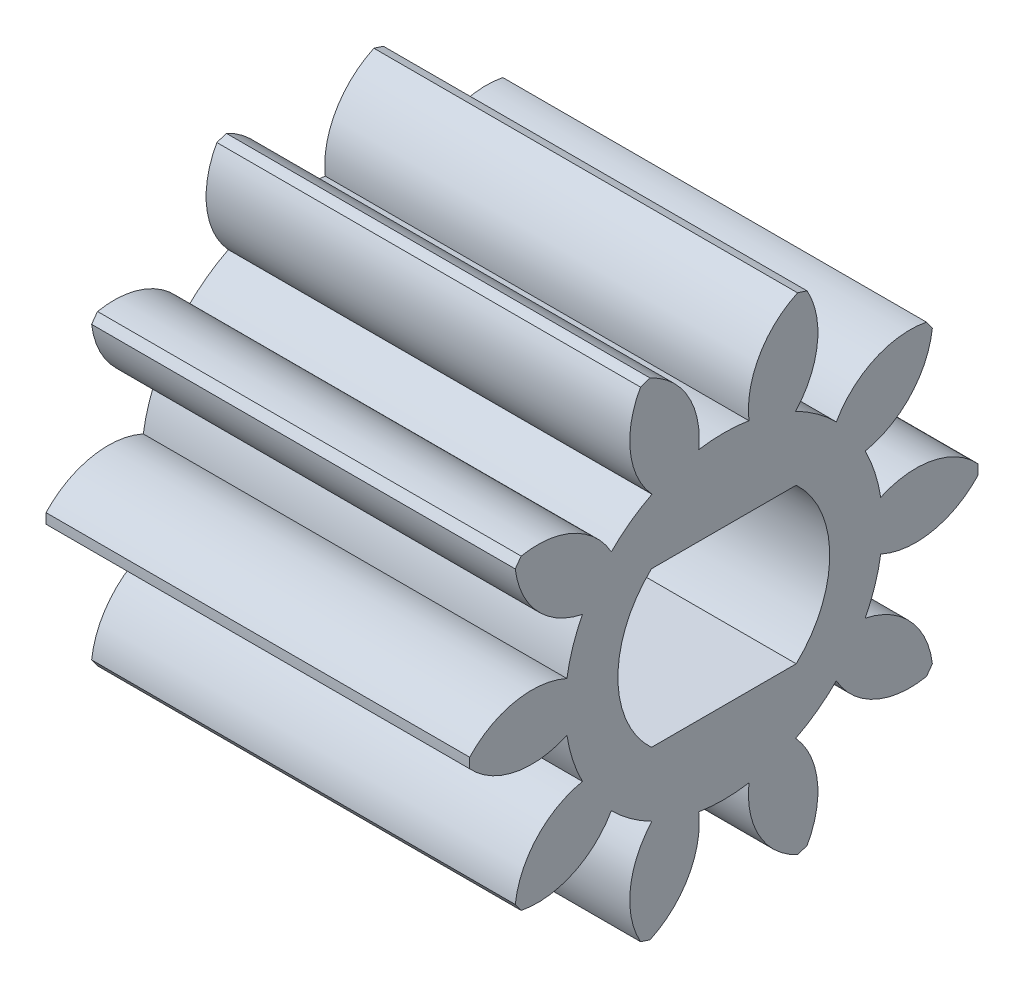
from build123d import *

# Parameters (mm, degrees)
BASPROSKE_W        = 10
BASPROSKE_H        = 6
TOOTHCUT_DEPTH     = 14.114877049
TEETHCUTS_COUNT    = 10
TEETHCUTS_ANGLE    = 324
BORSKE_R           = 0.4
BORE_DEPTH         = 50.0000508
SKETCH1_R          = 0.4
CUT_EXTRUDE1_DEPTH = 13.998849476


with BuildPart() as part:
    # BasProSke → Base-Revolve (revolve)
    with BuildSketch(Plane(origin=(0, 0, 0), x_dir=(1, 0, 0), z_dir=(0, 1, 0)), mode=Mode.PRIVATE) as base_revolve_sk:
        with Locations((5, 3)):
            Rectangle(BASPROSKE_W, BASPROSKE_H)
    revolve(base_revolve_sk.sketch.rotate(Axis((-10, 0, 0), (1, 0, 0)), 180), axis=Axis((-10, 0, 0), (1, 0, 0)))

    # TooCutSke → ToothCut (cut, through all)
    with BuildSketch(Plane(origin=(0, 0, 0), x_dir=(0, 0, -1), z_dir=(1, 0, 0))):
        with BuildLine():
            ThreePointArc((0.59278292, 3.701838653), (0, 3.749), (-0.59278292, 3.701838653))
            ThreePointArc((-0.59278292, 3.701838653), (-0.846593509, 4.924114224), (-1.775771316, 5.757784417))
            ThreePointArc((-1.775771316, 5.757784417), (0, 6.0254), (1.775771316, 5.757784417))
            ThreePointArc((1.775771316, 5.757784417), (0.846593509, 4.924114224), (0.59278292, 3.701838653))
        make_face()
    toothcut = extrude(amount=TOOTHCUT_DEPTH, mode=Mode.SUBTRACT)

    # TeethCuts: ToothCut ×10 about axis
    teethcuts_axis = Axis((-10, 0, 0), (1, 0, 0))
    for i in range(1, TEETHCUTS_COUNT):
        add(toothcut.rotate(teethcuts_axis, i * TEETHCUTS_ANGLE / (TEETHCUTS_COUNT - 1)), mode=Mode.SUBTRACT)

    # BorSke → Bore (cut, symmetric)
    with BuildSketch(Plane(origin=(0, 0, 0), x_dir=(0, 0, -1), z_dir=(1, 0, 0))):
        with Locations(Location((0, 0, 0), (0, 0, 180))):
            Circle(BORSKE_R)
    extrude(amount=BORE_DEPTH, both=True, mode=Mode.SUBTRACT)

    # Sketch1 → Cut-Extrude1 (cut, through all)
    with BuildSketch(Plane(origin=(10, 0, 0), x_dir=(0, 0, -1), z_dir=(1, 0, 0))):
        with BuildLine():
            ThreePointArc((-1.708617862, 1.825), (-2.5, 0), (-1.708617862, -1.825))
            Line((-1.708617862, -1.825), (1.708617862, -1.825))
            ThreePointArc((1.708617862, -1.825), (2.293637358, -0.994599252), (2.5, 0))
            ThreePointArc((2.5, 0), (2.293637358, 0.994599252), (1.708617862, 1.825))
            Line((1.708617862, 1.825), (-1.708617862, 1.825))
        make_face()
        Circle(SKETCH1_R, mode=Mode.SUBTRACT)
    extrude(amount=-CUT_EXTRUDE1_DEPTH, mode=Mode.SUBTRACT)


solid = part.part
